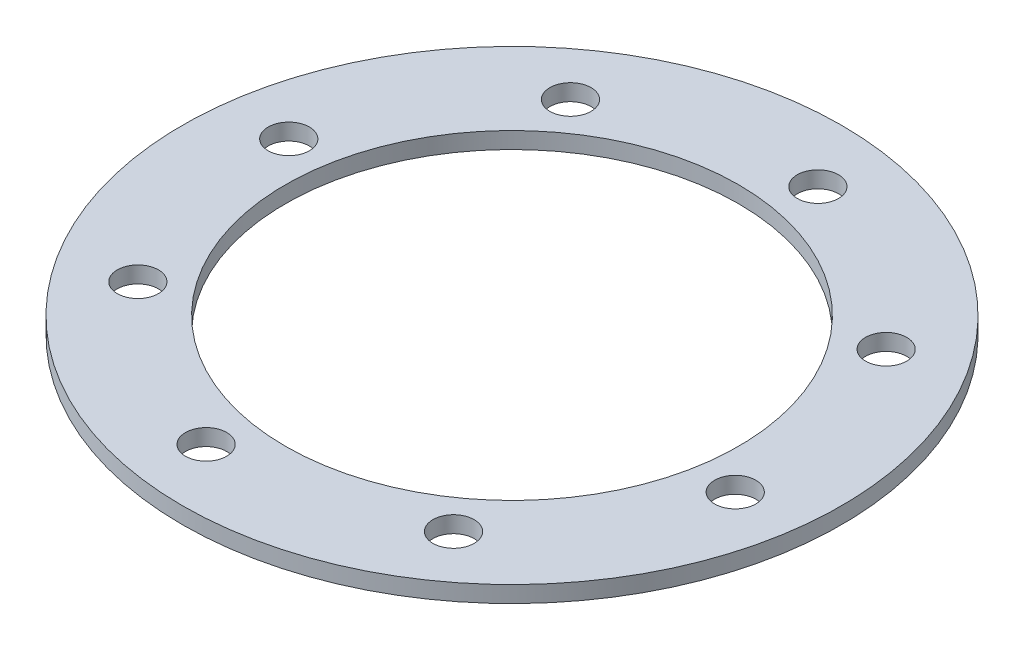
from build123d import *

# Parameters (mm, degrees)
SKETCH_1_R          = 40
SKETCH_1_R_2        = 27.5
EXTRUDE_1_DEPTH     = 2
CUT_EXTRUDE_1_DEPTH = 5


with BuildPart() as part:
    # 草图1 → 凸台-拉伸1 (new body)
    with BuildSketch(Plane(origin=(0, 0, 0), x_dir=(1, 0, 0), z_dir=(0, 1, 0))):
        with Locations(Location((0, 0, 0), (0, 0, 270))):
            Circle(SKETCH_1_R)
        with Locations(Location((0, 0, 0), (0, 0, 270))):
            Circle(SKETCH_1_R_2, mode=Mode.SUBTRACT)
    extrude(amount=EXTRUDE_1_DEPTH)

    # 草图2 → 切除-拉伸1 (cut)
    with BuildSketch(Plane.XZ):
        with BuildLine():
            ThreePointArc((-32.496342046, -2.547106912), (-34.580439739, -5.403072039), (-31.724474612, -7.487169732))
            ThreePointArc((-31.724474612, -7.487169732), (-29.640376919, -4.631204605), (-32.496342046, -2.547106912))
        make_face()
        with BuildLine():
            ThreePointArc((-26.639073723, 21.627866356), (-28.723171416, 18.771901229), (-25.867206289, 16.687803537))
            ThreePointArc((-25.867206289, 16.687803537), (-23.783108596, 19.543768664), (-26.639073723, 21.627866356))
        make_face()
        with BuildLine():
            ThreePointArc((-5.403072039, 34.580439739), (-7.487169732, 31.724474612), (-4.631204605, 29.640376919))
            ThreePointArc((-4.631204605, 29.640376919), (-2.547106912, 32.496342046), (-5.403072039, 34.580439739))
        make_face()
        with BuildLine():
            ThreePointArc((18.771901229, 28.723171416), (16.687803537, 25.867206289), (19.543768664, 23.783108596))
            ThreePointArc((19.543768664, 23.783108596), (21.627866356, 26.639073723), (18.771901229, 28.723171416))
        make_face()
        with BuildLine():
            ThreePointArc((31.724474612, 7.487169732), (29.640376919, 4.631204605), (32.496342046, 2.547106912))
            ThreePointArc((32.496342046, 2.547106912), (34.580439739, 5.403072039), (31.724474612, 7.487169732))
        make_face()
        with BuildLine():
            ThreePointArc((25.867206289, -16.687803537), (23.783108596, -19.543768664), (26.639073723, -21.627866356))
            ThreePointArc((26.639073723, -21.627866356), (28.723171416, -18.771901229), (25.867206289, -16.687803537))
        make_face()
        with BuildLine():
            ThreePointArc((-19.543768664, -23.783108596), (-21.627866356, -26.639073723), (-18.771901229, -28.723171416))
            ThreePointArc((-18.771901229, -28.723171416), (-16.687803537, -25.867206289), (-19.543768664, -23.783108596))
        make_face()
        with BuildLine():
            ThreePointArc((4.631204605, -29.640376919), (2.547106912, -32.496342046), (5.403072039, -34.580439739))
            ThreePointArc((5.403072039, -34.580439739), (7.487169732, -31.724474612), (4.631204605, -29.640376919))
        make_face()
    extrude(amount=-CUT_EXTRUDE_1_DEPTH, mode=Mode.SUBTRACT)


solid = part.part
